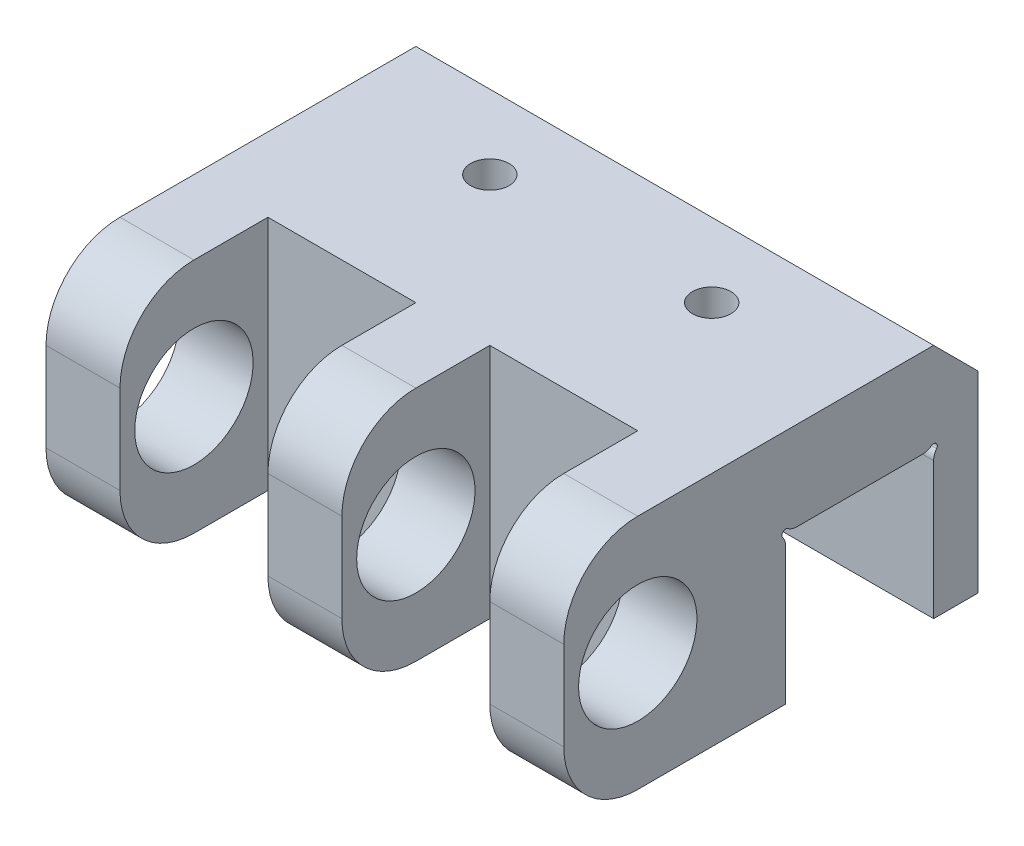
from build123d import *

# Parameters (mm, degrees)
SZKIC1_W                    = 70
SZKIC1_H                    = 32
DODANIE_WYCI_GNI_CIE1_DEPTH = 10
SZKIC2_W                    = 10
SZKIC2_H                    = 32
DODANIE_WYCI_GNI_CIE2_DEPTH = 20
SZKIC3_W                    = 70
SZKIC3_H                    = 12
DODANIE_WYCI_GNI_CIE3_DEPTH = 26
SZKIC4_W                    = 70
SZKIC4_H                    = 6
DODANIE_WYCI_GNI_CIE4_DEPTH = 20
SZKIC5_R                    = 0.5
WYTNIJ_WYCI_GNI_CIE1_DEPTH  = 83.607505712
ZAOKR_GLENIE1_R             = 2
SZKIC6_R                    = 8
WYTNIJ_WYCI_GNI_CIE2_DEPTH  = 83.607505712
ZAOKR_GLENIE2_R             = 10
SZKIC7_R                    = 2.6
WYTNIJ_WYCI_GNI_CIE3_DEPTH  = 79.74007874
SZKIC8_R                    = 2.6
WYTNIJ_WYCI_GNI_CIE4_DEPTH  = 20
SFAZOWANIE1_SIZE            = 6


with BuildPart() as part:
    # Szkic1 → Dodanie-wyciągnięcie1 (new body)
    with BuildSketch(Plane.XY):
        with Locations((35, 16)):
            Rectangle(SZKIC1_W, SZKIC1_H)
    extrude(amount=DODANIE_WYCI_GNI_CIE1_DEPTH)

    # Szkic2 → Dodanie-wyciągnięcie2 (add)
    with BuildSketch(Plane.XY.offset(10)):
        with Locations((5, 16)):
            Rectangle(SZKIC2_W, SZKIC2_H)
        with Locations((35, 16)):
            Rectangle(SZKIC2_W, SZKIC2_H)
        with Locations((65, 16)):
            Rectangle(SZKIC2_W, SZKIC2_H)
    extrude(amount=DODANIE_WYCI_GNI_CIE2_DEPTH)

    # Szkic3 → Dodanie-wyciągnięcie3 (add)
    with BuildSketch(Plane(origin=(0, 0, 0), x_dir=(-1, 0, 0), z_dir=(0, 0, -1))):
        with Locations((-35, 26)):
            Rectangle(SZKIC3_W, SZKIC3_H)
    extrude(amount=DODANIE_WYCI_GNI_CIE3_DEPTH)

    # Szkic4 → Dodanie-wyciągnięcie4 (add)
    with BuildSketch(Plane.XZ.offset(-20)):
        with Locations((35, -23)):
            Rectangle(SZKIC4_W, SZKIC4_H)
    extrude(amount=DODANIE_WYCI_GNI_CIE4_DEPTH)

    # Szkic5 → Wytnij-wyciągnięcie1 (cut, through all)
    with BuildSketch(Plane.ZY):
        with Locations((-20, 20)):
            Circle(SZKIC5_R)
        with Locations((0, 20)):
            Circle(SZKIC5_R)
    extrude(amount=-WYTNIJ_WYCI_GNI_CIE1_DEPTH, mode=Mode.SUBTRACT)

    # Zaokrąglenie1
    zaokr_glenie1_edges = [part.edges().sort_by_distance(p)[0] for p in [
        (35, 19.5, -20),
        (35, 19.5, 0),
        (35, 20, -19.5),
        (35, 20, -0.5),
    ]]
    fillet(zaokr_glenie1_edges, radius=ZAOKR_GLENIE1_R)

    # Szkic6 → Wytnij-wyciągnięcie2 (cut, through all)
    with BuildSketch(Plane.ZY):
        with Locations((20, 16)):
            Circle(SZKIC6_R)
    extrude(amount=-WYTNIJ_WYCI_GNI_CIE2_DEPTH, mode=Mode.SUBTRACT)

    # Zaokrąglenie2
    zaokr_glenie2_edges = [part.edges().sort_by_distance(p)[0] for p in [
        (5, 0, 30),
        (5, 32, 30),
        (35, 0, 30),
        (35, 32, 30),
        (65, 32, 30),
        (65, 0, 30),
    ]]
    fillet(zaokr_glenie2_edges, radius=ZAOKR_GLENIE2_R)

    # Szkic7 → Wytnij-wyciągnięcie3 (cut, through all)
    with BuildSketch(Plane.XZ.offset(-20)):
        with Locations(Location((20, -10, 0), (0, 0, 270))):
            Circle(SZKIC7_R)
        with Locations(Location((50, -10, 0), (0, 0, 270))):
            Circle(SZKIC7_R)
    extrude(amount=-WYTNIJ_WYCI_GNI_CIE3_DEPTH, mode=Mode.SUBTRACT)

    # Szkic8 → Wytnij-wyciągnięcie4 (cut)
    with BuildSketch(Plane(origin=(0, 0, -26), x_dir=(-1, 0, 0), z_dir=(0, 0, -1))):
        with Locations((-35, 10)):
            Circle(SZKIC8_R)
    extrude(amount=-WYTNIJ_WYCI_GNI_CIE4_DEPTH, mode=Mode.SUBTRACT)

    # Sfazowanie1
    sfazowanie1_edges = [part.edges().sort_by_distance(p)[0] for p in [
        (35, 32, -26),
    ]]
    chamfer(sfazowanie1_edges, length=SFAZOWANIE1_SIZE)


solid = part.part
